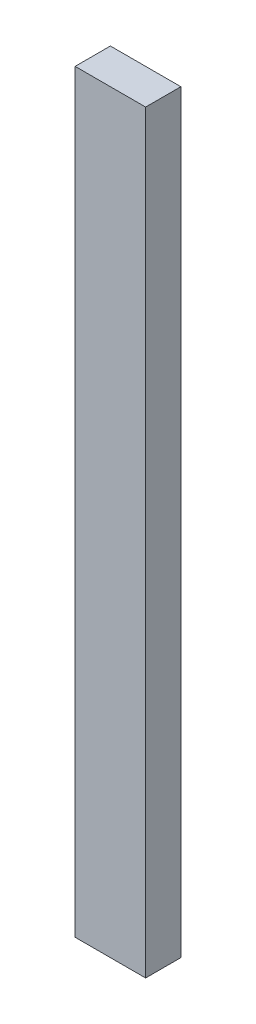
from build123d import *

# Parameters (mm, degrees)
SKETCH1_W           = 40
SKETCH1_H           = 20
BOSS_EXTRUDE1_DEPTH = 428


with BuildPart() as part:
    # Sketch1 → Boss-Extrude1 (new body)
    with BuildSketch(Plane(origin=(0, 0, 0), x_dir=(1, 0, 0), z_dir=(0, 1, 0))):
        with Locations((-217.333333333, 65)):
            Rectangle(SKETCH1_W, SKETCH1_H)
    extrude(amount=BOSS_EXTRUDE1_DEPTH)


solid = part.part
